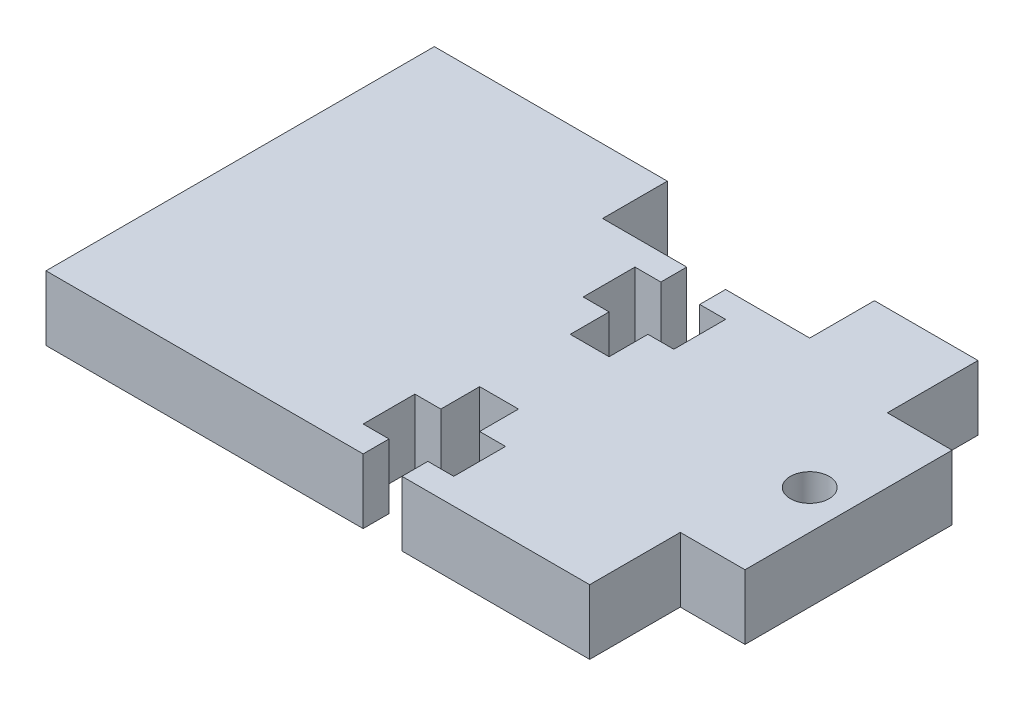
from build123d import *

# Parameters (mm, degrees)
CROQUIS1_W              = 32
CROQUIS1_H              = 30
SALIENTE_EXTRUIR1_DEPTH = 5
CORTAR_EXTRUIR1_DEPTH   = 23.494443758
CORTAR_EXTRUIR2_DEPTH   = 23.494443758
CROQUIS4_W              = 10
CROQUIS4_H              = 16
SALIENTE_EXTRUIR2_DEPTH = 5
CROQUIS5_R              = 1.5
CORTAR_EXTRUIR3_DEPTH   = 27.286878856
CROQUIS6_W              = 10
CROQUIS6_H              = 30
SALIENTE_EXTRUIR3_DEPTH = 5


with BuildPart() as part:
    # Croquis1 → Saliente-Extruir1 (new body)
    with BuildSketch(Plane(origin=(0, 0, 0), x_dir=(1, 0, 0), z_dir=(0, 1, 0))):
        Rectangle(CROQUIS1_W, CROQUIS1_H)
    extrude(amount=SALIENTE_EXTRUIR1_DEPTH)

    # Croquis2 → Cortar-Extruir1 (cut, through all)
    with BuildSketch(Plane(origin=(0, 5, 0), x_dir=(1, 0, 0), z_dir=(0, 1, 0))):
        Polygon((-8, 15), (8, 15), (8, 10), (1.5, 10), (1.5, 8), (3.5, 8), (3.5, 4), (1.5, 4), (1.5, 1), (-1.5, 1), (-1.5, 4), (-3.5, 4), (-3.5, 8), (-1.5, 8), (-1.5, 10), (-8, 10), align=None)
    extrude(amount=-CORTAR_EXTRUIR1_DEPTH, mode=Mode.SUBTRACT)

    # Croquis3 → Cortar-Extruir2 (cut, through all)
    with BuildSketch(Plane(origin=(0, 5, 0), x_dir=(1, 0, 0), z_dir=(0, 1, 0))):
        Polygon((1.5, -15), (1.5, -13), (3.5, -13), (3.5, -9), (1.5, -9), (1.5, -6), (-1.5, -6), (-1.5, -9), (-3.5, -9), (-3.5, -13), (-1.5, -13), (-1.5, -15), align=None)
    extrude(amount=-CORTAR_EXTRUIR2_DEPTH, mode=Mode.SUBTRACT)

    # Croquis4 → Saliente-Extruir2 (add)
    with BuildSketch(Plane(origin=(0, 5, 0), x_dir=(1, 0, 0), z_dir=(0, 1, 0))):
        with Locations((16, 0)):
            Rectangle(CROQUIS4_W, CROQUIS4_H)
    extrude(amount=-SALIENTE_EXTRUIR2_DEPTH)

    # Croquis5 → Cortar-Extruir3 (cut, through all)
    with BuildSketch(Plane(origin=(0, 5, 0), x_dir=(1, 0, 0), z_dir=(0, 1, 0))):
        with Locations(Location((18, 0, 0), (0, 0, 270))):
            Circle(CROQUIS5_R)
    extrude(amount=-CORTAR_EXTRUIR3_DEPTH, mode=Mode.SUBTRACT)

    # Croquis6 → Saliente-Extruir3 (add)
    with BuildSketch(Plane(origin=(0, 5, 0), x_dir=(1, 0, 0), z_dir=(0, 1, 0))):
        with Locations((-21, 0)):
            Rectangle(CROQUIS6_W, CROQUIS6_H)
    extrude(amount=-SALIENTE_EXTRUIR3_DEPTH)


solid = part.part
